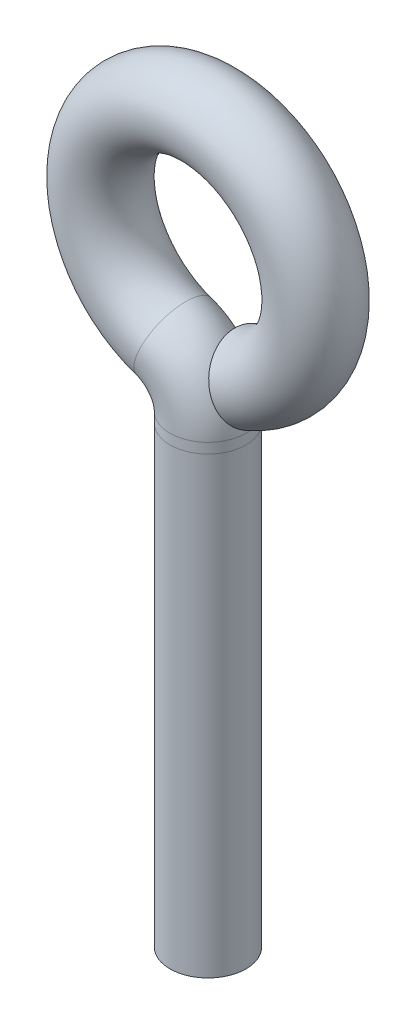
from build123d import *

# Parameters (mm, degrees)
SWEEP1_PROFILE_R = 1.524


with BuildPart() as part:
    # Sweep1: sweep along a path in Sketch1
    with BuildLine(Plane.XY) as sweep1_path:
        Line((0, 0), (0, 18.215024465))
        Line((0, 18.215024465), (0, 18.621898605))
        ThreePointArc((0, 18.621898605), (-0.381195396, 19.80674803), (-1.38176, 20.547051051))
        ThreePointArc((-1.38176, 20.547051051), (-0.149367757, 28.953415771), (1.661311056, 20.65237965))
    # Sweep1 profile (on start of the path) → Sweep1 (sweep)
    with BuildSketch(Plane.ZX):
        Circle(SWEEP1_PROFILE_R)
    sweep(path=sweep1_path.line)


solid = part.part
